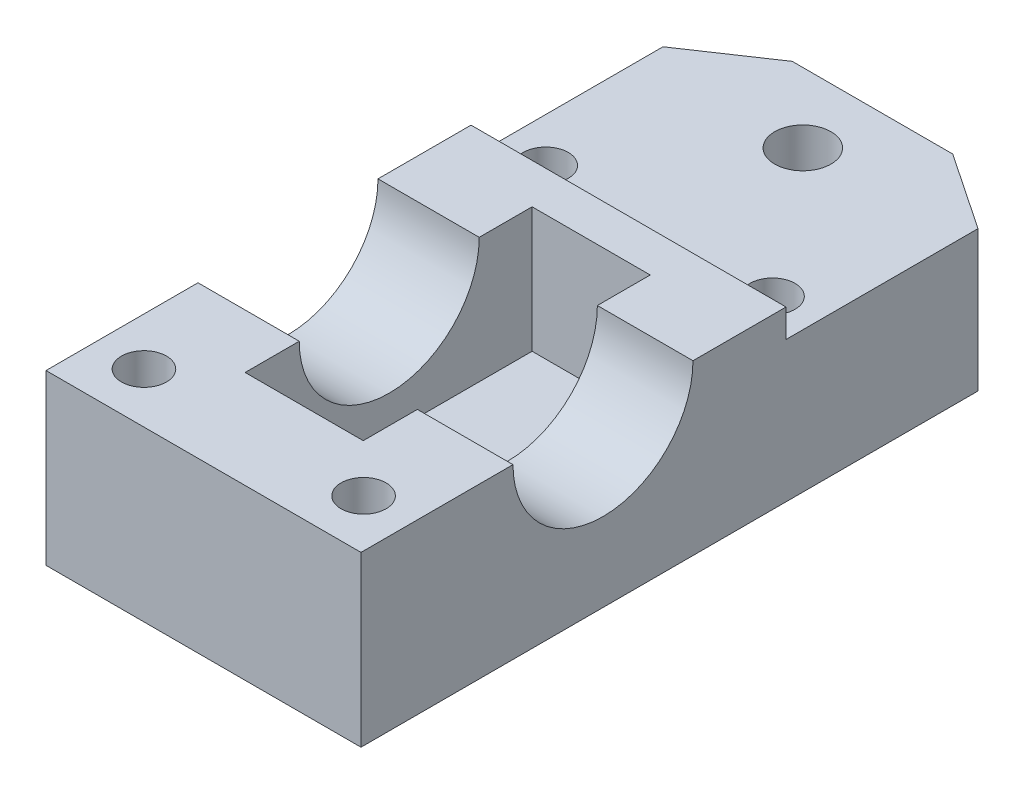
from build123d import *

# Parameters (mm, degrees)
SKETCH_1_R            = 2.5
EXTRUDE_1_DEPTH       = 15
CUT_EXTRUDE_START     = -8.5
SKETCH_4_W            = 25.510318362
SKETCH_4_H            = 11.123148158
CUT_EXTRUDE_1_DEPTH   = 10.5
SKETCH_5_R            = 8
CUT_EXTRUDE_2_DEPTH   = 45.795847434
SKETCH_6_R            = 2
CUT_EXTRUDE_3_DEPTH   = 38.665208712
SKETCH_7_W            = 21.685962805
SKETCH_7_H            = 6.466354348
CUT_EXTRUDE_2_2_DEPTH = 45.795847434
SKETCH_8_R            = 2
CUT_EXTRUDE_4_DEPTH   = 37.741229529


with BuildPart() as part:
    # Эскиз1 → Вытянуть1 (new body)
    with BuildSketch(Plane(origin=(0, 0, 0), x_dir=(1, 0, 0), z_dir=(0, 1, 0))):
        Polygon((14, 26.964204166), (7.131727139, 31.585882089), (-7.131727139, 31.585882089), (-14, 26.964204166), (-14, -27.88029884), (14, -27.88029884), align=None)
        with Locations(Location((0, 25.393583102, 0), (0, 0, 270))):
            Circle(SKETCH_1_R, mode=Mode.SUBTRACT)
    extrude(amount=EXTRUDE_1_DEPTH)

    # Эскиз4 → Вырез-Вытянуть1 (cut)
    with BuildSketch(Plane(origin=(14, 0, 0), x_dir=(0, 0, -1), z_dir=(1, 0, 0)).offset(CUT_EXTRUDE_START)):
        with Locations((-6.426786787, 9.438425921)):
            Rectangle(SKETCH_4_W, SKETCH_4_H)
    extrude(amount=-CUT_EXTRUDE_1_DEPTH, mode=Mode.SUBTRACT)

    # Эскиз5 → Cut-Extrude 2 (cut, through all)
    with BuildSketch(Plane(origin=(14, 0, 0), x_dir=(0, 0, -1), z_dir=(1, 0, 0))):
        with Locations((-6.37029618, 15)):
            Circle(SKETCH_5_R)
    extrude(amount=-CUT_EXTRUDE_2_DEPTH, mode=Mode.SUBTRACT)

    # Эскиз6 → Вытянуть3 (cut, through all)
    with BuildSketch(Plane(origin=(0, 15, 0), x_dir=(1, 0, 0), z_dir=(0, 1, 0))):
        with Locations(Location((-9.761047482, -23.411554498, 0), (0, 0, 270))):
            Circle(SKETCH_6_R)
        with Locations(Location((9.761047482, -23.411554498, 0), (0, 0, 90))):
            Circle(SKETCH_6_R)
    extrude(amount=-CUT_EXTRUDE_3_DEPTH, mode=Mode.SUBTRACT)

    # Эскиз7 → Cut-Extrude 2 2 (cut, through all)
    with BuildSketch(Plane.ZY.offset(14)):
        with Locations((-20.742900687, 15.733177174)):
            Rectangle(SKETCH_7_W, SKETCH_7_H)
    extrude(amount=-CUT_EXTRUDE_2_2_DEPTH, mode=Mode.SUBTRACT)

    # Эскиз8 → Вытянуть4 (cut, through all)
    with BuildSketch(Plane(origin=(0, 12.5, 0), x_dir=(1, 0, 0), z_dir=(0, 1, 0))):
        with Locations(Location((-10.080038917, 12.621065786, 0), (0, 0, 270))):
            Circle(SKETCH_8_R)
        with Locations(Location((10.080038917, 12.621065786, 0), (0, 0, 270))):
            Circle(SKETCH_8_R)
    extrude(amount=-CUT_EXTRUDE_4_DEPTH, mode=Mode.SUBTRACT)


solid = part.part
